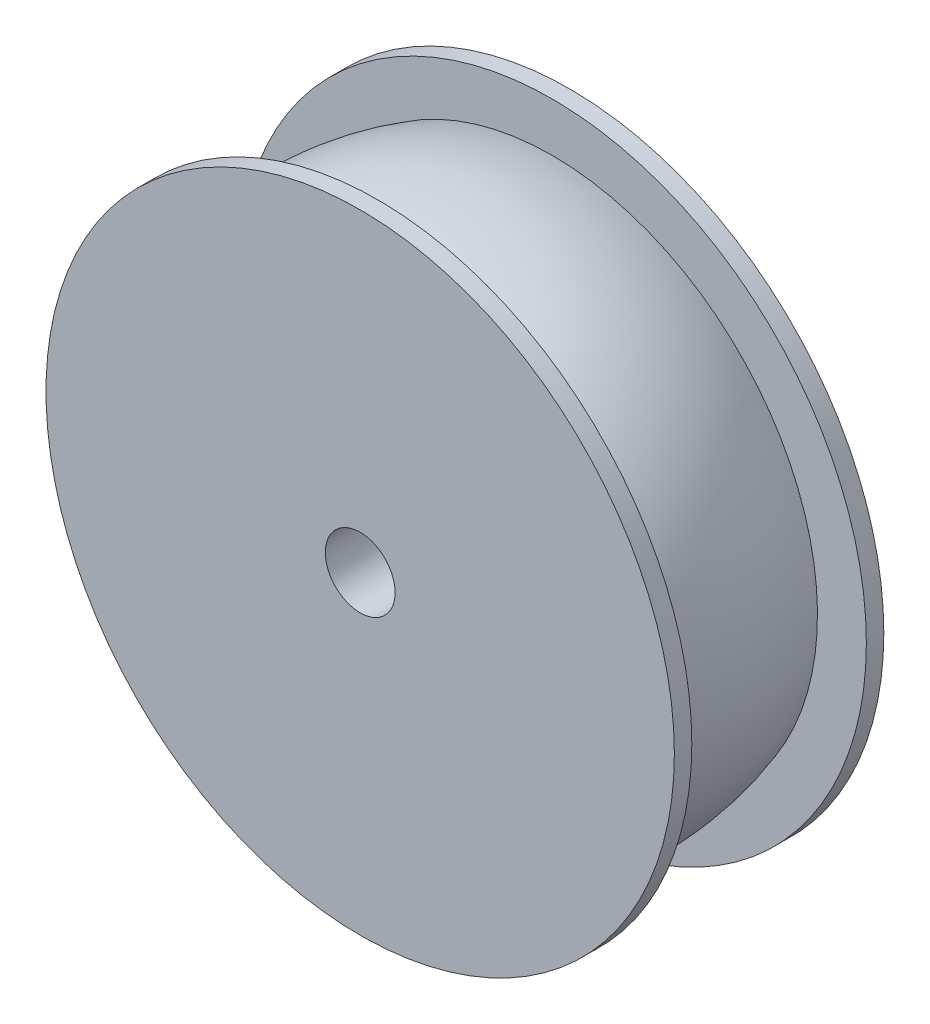
from build123d import *

# Parameters (mm, degrees)
SKETCH5_R          = 1
CUT_EXTRUDE1_DEPTH = 15.071247279


with BuildPart() as part:
    # Sketch1 → Revolve1 (revolve)
    with BuildSketch(Plane(origin=(0, 0, 0), x_dir=(0, 0, -1), z_dir=(1, 0, 0)), mode=Mode.PRIVATE) as revolve1_sk:
        with BuildLine():
            Line((0, 0), (0, 8))
            ThreePointArc((0, 8), (-1.265950905, 7.899200485), (-2.5, 7.599342077))
            Line((-2.5, 7.599342077), (-2.5, 8))
            Line((-2.5, 8), (-2.5, 9))
            Line((-2.5, 9), (-3, 9))
            Line((-3, 9), (-3, 0))
            Line((-3, 0), (0, 0))
        make_face()
        with BuildLine():
            ThreePointArc((2.5, 7.599342077), (1.265950905, 7.899200485), (0, 8))
            Line((0, 8), (0, 0))
            Line((0, 0), (3, 0))
            Line((3, 0), (3, 9))
            Line((3, 9), (2.5, 9))
            Line((2.5, 9), (2.5, 8))
            Line((2.5, 8), (2.5, 7.599342077))
        make_face()
    revolve(revolve1_sk.sketch.rotate(Axis((0, 0, 8.025320303), (0, 0, -1)), 90), axis=Axis((0, 0, 8.025320303), (0, 0, -1)))

    # Sketch5 → Cut-Extrude1 (cut, through all)
    with BuildSketch(Plane.XY.offset(3)):
        Circle(SKETCH5_R)
    extrude(amount=-CUT_EXTRUDE1_DEPTH, mode=Mode.SUBTRACT)


solid = part.part
